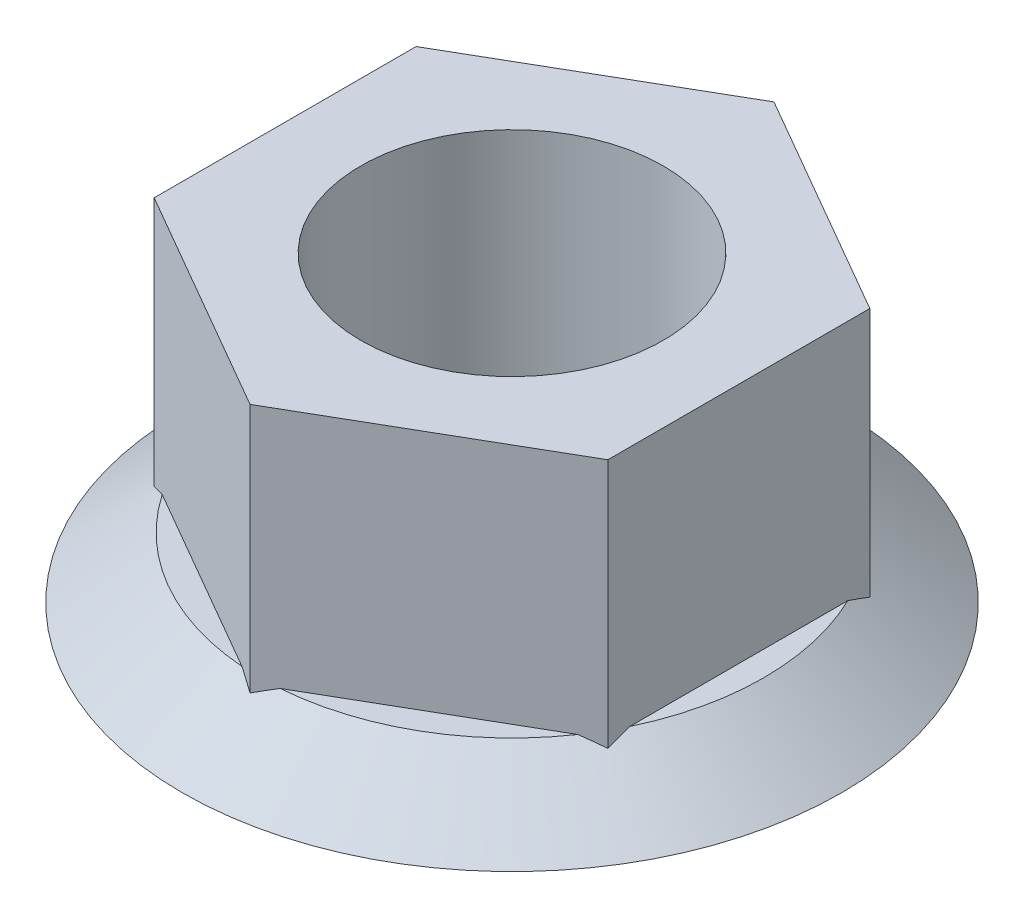
from build123d import *

# Parameters (mm, degrees)
DODANIE_WYCI_GNI_CIE1_START = 8
SZKIC2_R                    = 5
DODANIE_WYCI_GNI_CIE1_DEPTH = 10


with BuildPart() as part:
    # Szkic1 → Obrót1 (revolve)
    with BuildSketch(Plane.XY, mode=Mode.PRIVATE) as obr_t1_sk:
        Polygon((5, 0), (5, 2), (8.32, 2), (10.9, 0), align=None)
    revolve(obr_t1_sk.sketch.rotate(Axis((0, 0, 0), (0, 1, 0)), 90), axis=Axis((0, 0, 0), (0, 1, 0)))

    # Szkic2 → Dodanie-wyciągnięcie1 (add)
    with BuildSketch(Plane(origin=(0, 2, 0), x_dir=(1, 0, 0), z_dir=(0, 1, 0)).offset(DODANIE_WYCI_GNI_CIE1_START)):
        Polygon((0, 8.660254038), (-7.5, 4.330127019), (-7.5, -4.330127019), (0, -8.660254038), (7.5, -4.330127019), (7.5, 4.330127019), align=None)
        with Locations(Location((0, 0, 0), (0, 0, 90))):
            Circle(SZKIC2_R, mode=Mode.SUBTRACT)
    extrude(amount=-DODANIE_WYCI_GNI_CIE1_DEPTH)


solid = part.part
